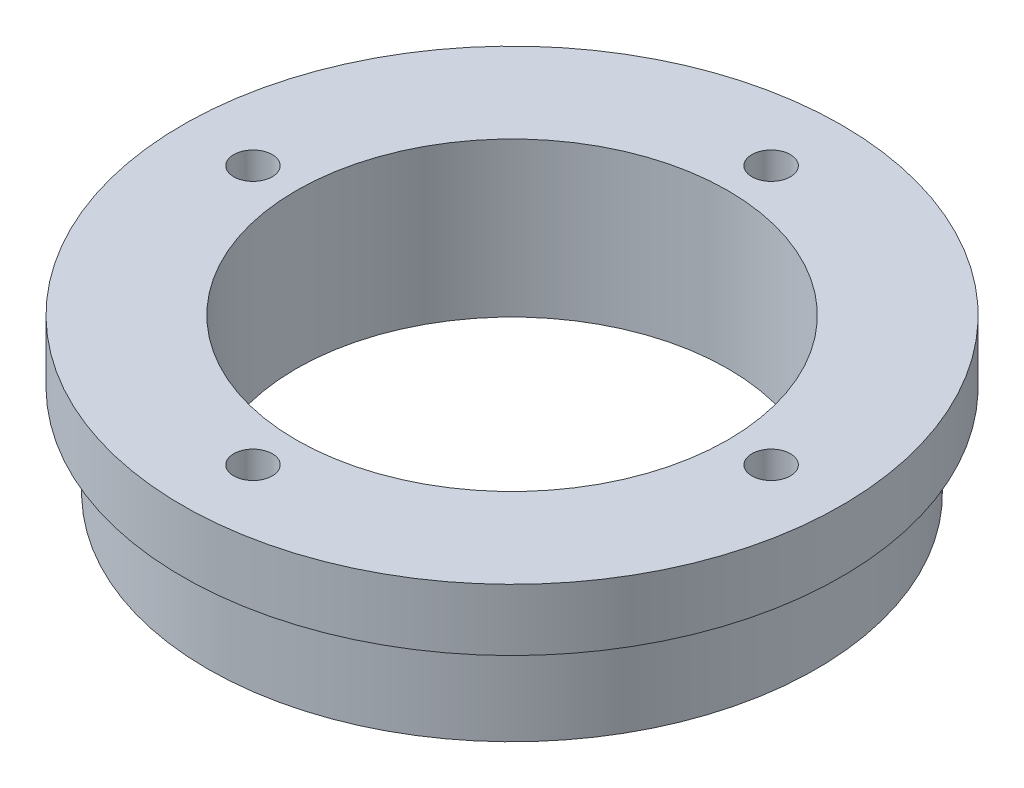
from build123d import *

# Parameters (mm, degrees)
CIRPATTERN1_COUNT = 4


with BuildPart() as part:
    # Sketch1 → Revolve1 (revolve)
    with BuildSketch(Plane.XY, mode=Mode.PRIVATE) as revolve1_sk:
        Polygon((67.8561, 0), (44.45, 0), (44.45, -31.75), (62.6618, -31.75), (62.6618, -12.7), (67.8561, -12.7), align=None)
    revolve(revolve1_sk.sketch.rotate(Axis((0, -31.75, 0), (0, 1, 0)), 90), axis=Axis((0, -31.75, 0), (0, 1, 0)))

    # Sketch3 → 3/8-16 Tapped Hole1 (revolve, cut)
    with BuildSketch(Plane(origin=(0, 0, -53.34), x_dir=(0, 0, 1), z_dir=(1, 0, 0))):
        Polygon((0, 0), (0, 29.384865582), (3.96875, 27.0002), (3.96875, 0), align=None)
    f_3_8_16_tapped_hole1 = revolve(axis=Axis((0, 6.35, -53.34), (0, -1, 0)), mode=Mode.SUBTRACT)

    # CirPattern1: 3/8-16 Tapped Hole1 ×4 about axis
    cirpattern1_axis = Axis((0, 0, 0), (0, 1, 0))
    for i in range(1, CIRPATTERN1_COUNT):
        add(f_3_8_16_tapped_hole1.rotate(cirpattern1_axis, i * 360 / CIRPATTERN1_COUNT), mode=Mode.SUBTRACT)


solid = part.part
